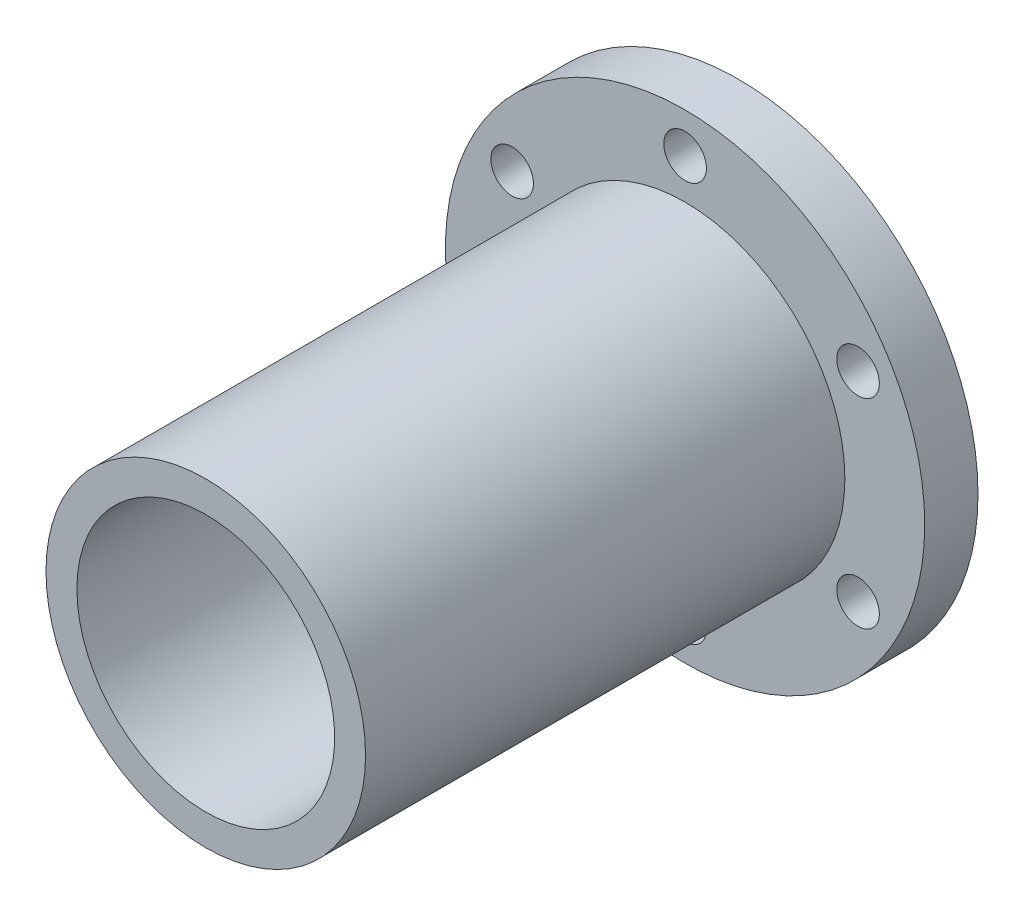
from build123d import *

# Parameters (mm, degrees)
SKETCH1_R           = 22.5
BOSS_EXTRUDE1_DEPTH = 5
SKETCH2_R           = 15
SKETCH2_R_2         = 12.1
BOSS_EXTRUDE2_DEPTH = 45
SKETCH3_R           = 2
CUT_EXTRUDE1_DEPTH  = 5


with BuildPart() as part:
    # Sketch1 → Boss-Extrude1 (new body)
    with BuildSketch(Plane.XY):
        Circle(SKETCH1_R)
    extrude(amount=BOSS_EXTRUDE1_DEPTH)

    # Sketch2 → Boss-Extrude2 (add)
    with BuildSketch(Plane.XY.offset(5)):
        with Locations(Location((0, 0, 0), (0, 0, 180))):
            Circle(SKETCH2_R)
        with Locations(Location((0, 0, 0), (0, 0, 180))):
            Circle(SKETCH2_R_2, mode=Mode.SUBTRACT)
    extrude(amount=BOSS_EXTRUDE2_DEPTH)

    # Sketch3 → Cut-Extrude1 (cut)
    with BuildSketch(Plane.XY.offset(5)):
        with Locations((0, 18.75)):
            Circle(SKETCH3_R)
        with Locations((16.237976321, 9.375)):
            Circle(SKETCH3_R)
        with Locations((16.237976321, -9.375)):
            Circle(SKETCH3_R)
        with Locations((0, -18.75)):
            Circle(SKETCH3_R)
        with Locations((-16.237976321, -9.375)):
            Circle(SKETCH3_R)
        with Locations((-16.237976321, 9.375)):
            Circle(SKETCH3_R)
    extrude(amount=-CUT_EXTRUDE1_DEPTH, mode=Mode.SUBTRACT)


solid = part.part
